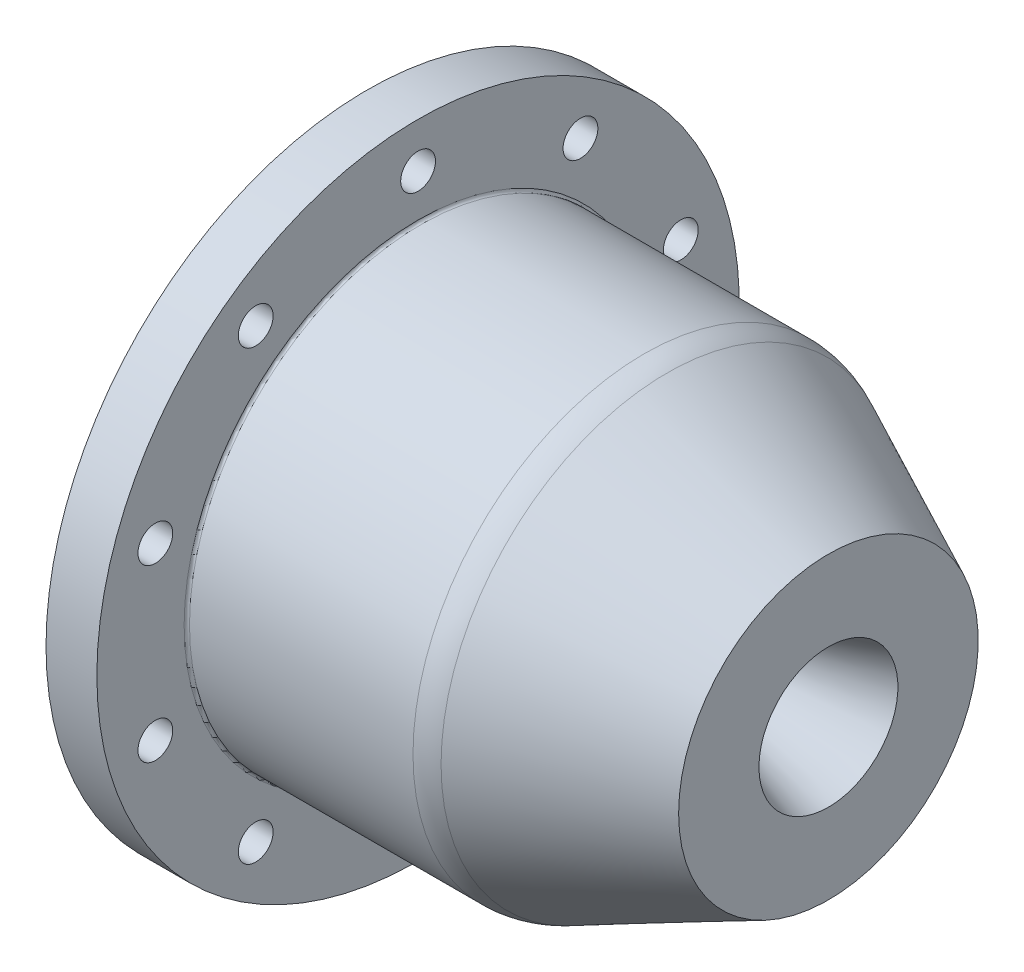
from build123d import *

# Parameters (mm, degrees)
HOLES_R            = 3.25
CUT_EXTRUDE2_DEPTH = 121.915154753
SKETCH9_R          = 1.8
PROBE_HOLE_DEPTH   = 57
FILLET1_R          = 10
FILLET2_R          = 0.5
FILLET3_R          = 1.2


with BuildPart() as part:
    # Cross_section → Revolve 2 (revolve)
    with BuildSketch(Plane.XY, mode=Mode.PRIVATE) as revolve_2_sk:
        with BuildLine():
            Line((21.032889293, 6.834), (39.942176945, 12.978))
            Line((39.942176945, 12.978), (39.942176945, 27.978))
            Line((39.942176945, 27.978), (7.796597981, 43.2))
            Line((7.796597981, 43.2), (-36.7, 43.2))
            Line((-36.7, 43.2), (-36.7, 60))
            Line((-36.7, 60), (-46.2, 60))
            Line((-46.2, 60), (-46.2, 31))
            Line((-46.2, 31), (-46.7, 31))
            Line((-46.7, 31), (-46.7, 25))
            Line((-46.7, 25), (0, 25))
            ThreePointArc((0, 25), (4.5, 23.794228634), (7.794228634, 20.5))
            Line((7.794228634, 20.5), (13.238660659, 11.334))
            ThreePointArc((13.238660659, 11.334), (16.532889293, 8.039771366), (21.032889293, 6.834))
        make_face()
    revolve(revolve_2_sk.sketch.rotate(Axis((0, 0, 0), (1, 0, 0)), 90), axis=Axis((0, 0, 0), (1, 0, 0)))

    # holes → Cut-Extrude2 (cut, through all)
    with BuildSketch(Plane.ZY.offset(46.2)):
        with Locations((0, 51.6)):
            Circle(HOLES_R)
        with Locations((30.329719018, 41.74527691)):
            Circle(HOLES_R)
        with Locations((49.074516241, 15.94527691)):
            Circle(HOLES_R)
        with Locations((49.074516241, -15.94527691)):
            Circle(HOLES_R)
        with Locations((30.329719018, -41.74527691)):
            Circle(HOLES_R)
        with Locations((0, -51.6)):
            Circle(HOLES_R)
        with Locations((-30.329719018, -41.74527691)):
            Circle(HOLES_R)
        with Locations((-49.074516241, -15.94527691)):
            Circle(HOLES_R)
        with Locations((-49.074516241, 15.94527691)):
            Circle(HOLES_R)
        with Locations((-30.329719018, 41.74527691)):
            Circle(HOLES_R)
    extrude(amount=-CUT_EXTRUDE2_DEPTH, mode=Mode.SUBTRACT)

    # Sketch9 → probe_hole (cut)
    with BuildSketch(Plane(origin=(0, 0, 0), x_dir=(1, 0, 0), z_dir=(0, -0.587785252292477, 0.8090169943749446))):
        with Locations(Location((-23.35, 0, 0), (0, 0, 270))):
            Circle(SKETCH9_R)
    extrude(amount=-PROBE_HOLE_DEPTH, mode=Mode.SUBTRACT)

    # Fillet1
    fillet1_edges = [part.edges().sort_by_distance(p)[0] for p in [
        (7.796597981, 0, -43.2),
    ]]
    fillet(fillet1_edges, radius=FILLET1_R)

    # Fillet2
    fillet2_edges = [part.edges().sort_by_distance(p)[0] for p in [
        (-36.7, 0, -43.2),
    ]]
    fillet(fillet2_edges, radius=FILLET2_R)

    # Fillet3
    fillet3_edges = [part.edges().sort_by_distance(p)[0] for p in [
        (21.032889293, 0, -6.834),
    ]]
    fillet(fillet3_edges, radius=FILLET3_R)


solid = part.part
